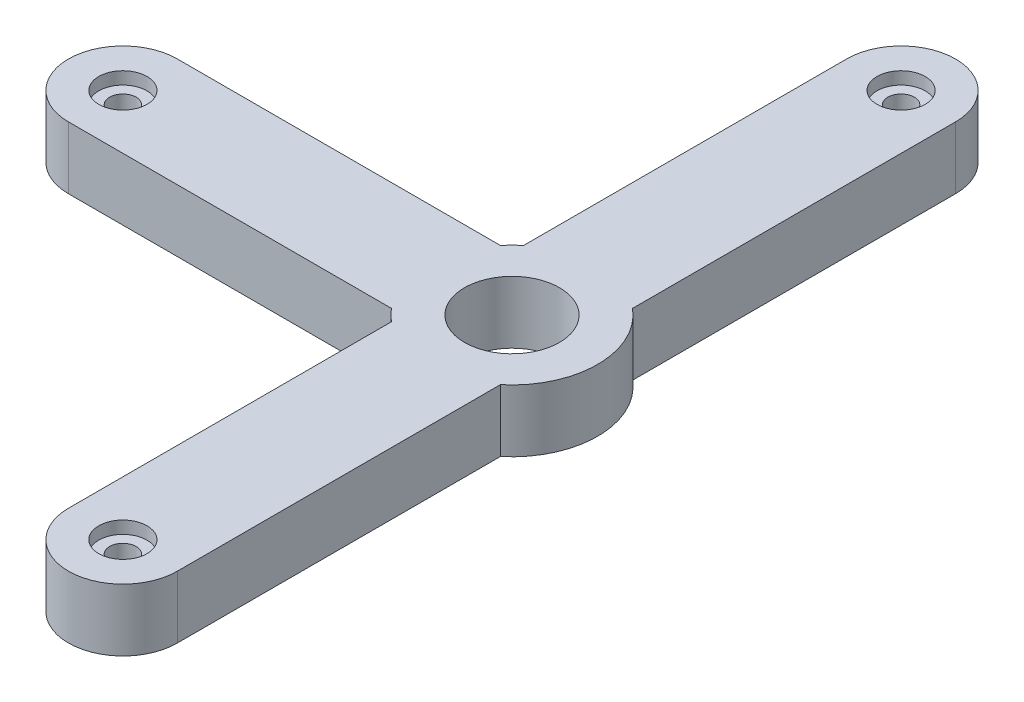
from build123d import *

# Parameters (mm, degrees)
BASE_OUTLINE_SKETCH_R          = 1.7
BASE_OUTLINE_SKETCH_R_2        = 6.1
BASE_OUTLINE_SKETCH_R_3        = 1.6
BASE_OUTLINE_DEPTH             = 4
INTERFACE_PROFILE_2_SKETCH_R   = 1.7
INTERFACE_PROFILE_2_SKETCH_R_2 = 6.1
INTERFACE_PROFILE_2_SKETCH_R_3 = 1.1
INTERFACE_PROFILE_2_DEPTH      = 2.4
INTERFACE_PROFILE_3_SKETCH_R   = 6.1
INTERFACE_PROFILE_3_SKETCH_R_2 = 3.1
INTERFACE_PROFILE_3_SKETCH_R_3 = 1.1
INTERFACE_PROFILE_3_DEPTH      = 0.6
INTERFACE_PROFILE_4_SKETCH_R   = 6.1
INTERFACE_PROFILE_4_SKETCH_R_2 = 3.1
INTERFACE_PROFILE_4_DEPTH      = 1


with BuildPart() as part:
    # Base Outline Sketch → Base Outline (new body)
    with BuildSketch(Plane(origin=(0, -157, 0), x_dir=(1, 0, 0), z_dir=(0, 1, 0))):
        with BuildLine():
            Line((-106.291651246, -7), (-64.77693262, -7))
            ThreePointArc((-64.77693262, -7), (-64.069825839, -7.778174593), (-63.291651246, -8.485281374))
            Line((-63.291651246, -8.485281374), (-63.291651246, -50))
            ThreePointArc((-63.291651246, -50), (-56.291651246, -57), (-49.291651246, -50))
            Line((-49.291651246, -50), (-49.291651246, -8.485281374))
            ThreePointArc((-49.291651246, -8.485281374), (-45.291651246, 0), (-49.291651246, 8.485281374))
            Line((-49.291651246, 8.485281374), (-49.291651246, 50))
            ThreePointArc((-49.291651246, 50), (-56.291651246, 57), (-63.291651246, 50))
            Line((-63.291651246, 50), (-63.291651246, 8.485281374))
            ThreePointArc((-63.291651246, 8.485281374), (-64.069825839, 7.778174593), (-64.77693262, 7))
            Line((-64.77693262, 7), (-106.291651246, 7))
            ThreePointArc((-106.291651246, 7), (-113.291651246, 0), (-106.291651246, -7))
        make_face()
        with Locations(Location((-106.291651246, 0, 0), (0, 0, 270))):
            Circle(BASE_OUTLINE_SKETCH_R, mode=Mode.SUBTRACT)
        with Locations(Location((-56.291651246, 50, 0), (0, 0, 270))):
            Circle(BASE_OUTLINE_SKETCH_R, mode=Mode.SUBTRACT)
        with Locations(Location((-56.291651246, 0, 0), (0, 0, 270))):
            Circle(BASE_OUTLINE_SKETCH_R_2, mode=Mode.SUBTRACT)
        with Locations(Location((-56.291651246, -50, 0), (0, 0, 270))):
            Circle(BASE_OUTLINE_SKETCH_R, mode=Mode.SUBTRACT)
        with Locations(Location((-65.291651246, 0, 0), (0, 0, 270))):
            Circle(BASE_OUTLINE_SKETCH_R_3, mode=Mode.SUBTRACT)
        with Locations(Location((-56.291651246, -9, 0), (0, 0, 270))):
            Circle(BASE_OUTLINE_SKETCH_R_3, mode=Mode.SUBTRACT)
        with Locations(Location((-56.291651246, 9, 0), (0, 0, 270))):
            Circle(BASE_OUTLINE_SKETCH_R_3, mode=Mode.SUBTRACT)
    extrude(amount=BASE_OUTLINE_DEPTH)

    # Interface Profile 2 Sketch → Interface Profile 2 (add)
    with BuildSketch(Plane(origin=(0, -153, 0), x_dir=(1, 0, 0), z_dir=(0, 1, 0))):
        with BuildLine():
            Line((-106.291651246, -7), (-64.77693262, -7))
            ThreePointArc((-64.77693262, -7), (-64.069825839, -7.778174593), (-63.291651246, -8.485281374))
            Line((-63.291651246, -8.485281374), (-63.291651246, -50))
            ThreePointArc((-63.291651246, -50), (-56.291651246, -57), (-49.291651246, -50))
            Line((-49.291651246, -50), (-49.291651246, -8.485281374))
            ThreePointArc((-49.291651246, -8.485281374), (-45.291651246, 0), (-49.291651246, 8.485281374))
            Line((-49.291651246, 8.485281374), (-49.291651246, 50))
            ThreePointArc((-49.291651246, 50), (-56.291651246, 57), (-63.291651246, 50))
            Line((-63.291651246, 50), (-63.291651246, 8.485281374))
            ThreePointArc((-63.291651246, 8.485281374), (-64.069825839, 7.778174593), (-64.77693262, 7))
            Line((-64.77693262, 7), (-106.291651246, 7))
            ThreePointArc((-106.291651246, 7), (-113.291651246, 0), (-106.291651246, -7))
        make_face()
        with Locations(Location((-106.291651246, 0, 0), (0, 0, 270))):
            Circle(INTERFACE_PROFILE_2_SKETCH_R, mode=Mode.SUBTRACT)
        with Locations(Location((-56.291651246, 50, 0), (0, 0, 270))):
            Circle(INTERFACE_PROFILE_2_SKETCH_R, mode=Mode.SUBTRACT)
        with Locations(Location((-56.291651246, 0, 0), (0, 0, 270))):
            Circle(INTERFACE_PROFILE_2_SKETCH_R_2, mode=Mode.SUBTRACT)
        with Locations(Location((-56.291651246, -50, 0), (0, 0, 270))):
            Circle(INTERFACE_PROFILE_2_SKETCH_R, mode=Mode.SUBTRACT)
        with Locations(Location((-65.291651246, 0, 0), (0, 0, 270))):
            Circle(INTERFACE_PROFILE_2_SKETCH_R_3, mode=Mode.SUBTRACT)
        with Locations(Location((-56.291651246, -9, 0), (0, 0, 270))):
            Circle(INTERFACE_PROFILE_2_SKETCH_R_3, mode=Mode.SUBTRACT)
        with Locations(Location((-56.291651246, 9, 0), (0, 0, 270))):
            Circle(INTERFACE_PROFILE_2_SKETCH_R_3, mode=Mode.SUBTRACT)
    extrude(amount=INTERFACE_PROFILE_2_DEPTH)

    # Interface Profile 3 Sketch → Interface Profile 3 (add)
    with BuildSketch(Plane(origin=(0, -150.6, 0), x_dir=(1, 0, 0), z_dir=(0, 1, 0))):
        with BuildLine():
            Line((-106.291651246, -7), (-64.77693262, -7))
            ThreePointArc((-64.77693262, -7), (-64.069825839, -7.778174593), (-63.291651246, -8.485281374))
            Line((-63.291651246, -8.485281374), (-63.291651246, -50))
            ThreePointArc((-63.291651246, -50), (-56.291651246, -57), (-49.291651246, -50))
            Line((-49.291651246, -50), (-49.291651246, -8.485281374))
            ThreePointArc((-49.291651246, -8.485281374), (-45.291651246, 0), (-49.291651246, 8.485281374))
            Line((-49.291651246, 8.485281374), (-49.291651246, 50))
            ThreePointArc((-49.291651246, 50), (-56.291651246, 57), (-63.291651246, 50))
            Line((-63.291651246, 50), (-63.291651246, 8.485281374))
            ThreePointArc((-63.291651246, 8.485281374), (-64.069825839, 7.778174593), (-64.77693262, 7))
            Line((-64.77693262, 7), (-106.291651246, 7))
            ThreePointArc((-106.291651246, 7), (-113.291651246, 0), (-106.291651246, -7))
        make_face()
        with Locations(Location((-56.291651246, 0, 0), (0, 0, 270))):
            Circle(INTERFACE_PROFILE_3_SKETCH_R, mode=Mode.SUBTRACT)
        with Locations(Location((-106.291651246, 0, 0), (0, 0, 270))):
            Circle(INTERFACE_PROFILE_3_SKETCH_R_2, mode=Mode.SUBTRACT)
        with Locations(Location((-56.291651246, 50, 0), (0, 0, 270))):
            Circle(INTERFACE_PROFILE_3_SKETCH_R_2, mode=Mode.SUBTRACT)
        with Locations(Location((-56.291651246, -50, 0), (0, 0, 270))):
            Circle(INTERFACE_PROFILE_3_SKETCH_R_2, mode=Mode.SUBTRACT)
        with Locations(Location((-65.291651246, 0, 0), (0, 0, 270))):
            Circle(INTERFACE_PROFILE_3_SKETCH_R_3, mode=Mode.SUBTRACT)
        with Locations(Location((-56.291651246, -9, 0), (0, 0, 270))):
            Circle(INTERFACE_PROFILE_3_SKETCH_R_3, mode=Mode.SUBTRACT)
        with Locations(Location((-56.291651246, 9, 0), (0, 0, 270))):
            Circle(INTERFACE_PROFILE_3_SKETCH_R_3, mode=Mode.SUBTRACT)
    extrude(amount=INTERFACE_PROFILE_3_DEPTH)

    # Interface Profile 4 Sketch → Interface Profile 4 (add)
    with BuildSketch(Plane(origin=(0, -150, 0), x_dir=(1, 0, 0), z_dir=(0, 1, 0))):
        with BuildLine():
            Line((-106.291651246, -7), (-64.77693262, -7))
            ThreePointArc((-64.77693262, -7), (-64.069825839, -7.778174593), (-63.291651246, -8.485281374))
            Line((-63.291651246, -8.485281374), (-63.291651246, -50))
            ThreePointArc((-63.291651246, -50), (-56.291651246, -57), (-49.291651246, -50))
            Line((-49.291651246, -50), (-49.291651246, -8.485281374))
            ThreePointArc((-49.291651246, -8.485281374), (-45.291651246, 0), (-49.291651246, 8.485281374))
            Line((-49.291651246, 8.485281374), (-49.291651246, 50))
            ThreePointArc((-49.291651246, 50), (-56.291651246, 57), (-63.291651246, 50))
            Line((-63.291651246, 50), (-63.291651246, 8.485281374))
            ThreePointArc((-63.291651246, 8.485281374), (-64.069825839, 7.778174593), (-64.77693262, 7))
            Line((-64.77693262, 7), (-106.291651246, 7))
            ThreePointArc((-106.291651246, 7), (-113.291651246, 0), (-106.291651246, -7))
        make_face()
        with Locations(Location((-56.291651246, 0, 0), (0, 0, 270))):
            Circle(INTERFACE_PROFILE_4_SKETCH_R, mode=Mode.SUBTRACT)
        with Locations(Location((-106.291651246, 0, 0), (0, 0, 270))):
            Circle(INTERFACE_PROFILE_4_SKETCH_R_2, mode=Mode.SUBTRACT)
        with Locations(Location((-56.291651246, 50, 0), (0, 0, 270))):
            Circle(INTERFACE_PROFILE_4_SKETCH_R_2, mode=Mode.SUBTRACT)
        with Locations(Location((-56.291651246, -50, 0), (0, 0, 270))):
            Circle(INTERFACE_PROFILE_4_SKETCH_R_2, mode=Mode.SUBTRACT)
    extrude(amount=INTERFACE_PROFILE_4_DEPTH)


solid = part.part
